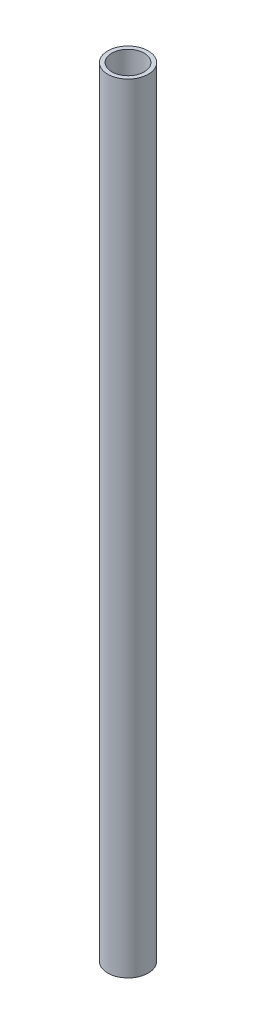
from build123d import *

# Parameters (mm, degrees)
SKETCH1_R           = 15.875
SKETCH1_R_2         = 12.7
BOSS_EXTRUDE1_DEPTH = 609.6


with BuildPart() as part:
    # Sketch1 → Boss-Extrude1 (new body)
    with BuildSketch(Plane(origin=(0, 0, 0), x_dir=(1, 0, 0), z_dir=(0, 1, 0))):
        with Locations(Location((0, -0.506202841, 0), (0, 0, 90))):
            Circle(SKETCH1_R)
        with Locations(Location((0, -0.506202841, 0), (0, 0, 90))):
            Circle(SKETCH1_R_2, mode=Mode.SUBTRACT)
    extrude(amount=BOSS_EXTRUDE1_DEPTH)


solid = part.part
